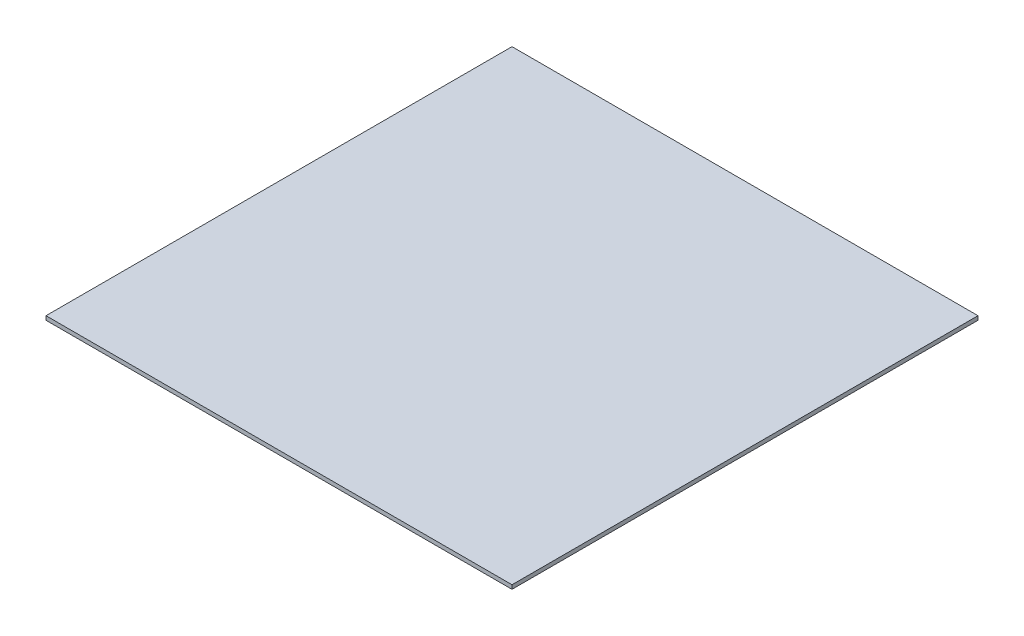
from build123d import *

# Parameters (mm, degrees)
SKETCH1_W           = 700
SKETCH1_H           = 700
BOSS_EXTRUDE1_DEPTH = 6


with BuildPart() as part:
    # Sketch1 → Boss-Extrude1 (new body)
    with BuildSketch(Plane(origin=(0, 0, 0), x_dir=(1, 0, 0), z_dir=(0, 1, 0))):
        Rectangle(SKETCH1_W, SKETCH1_H)
    extrude(amount=BOSS_EXTRUDE1_DEPTH)


solid = part.part
